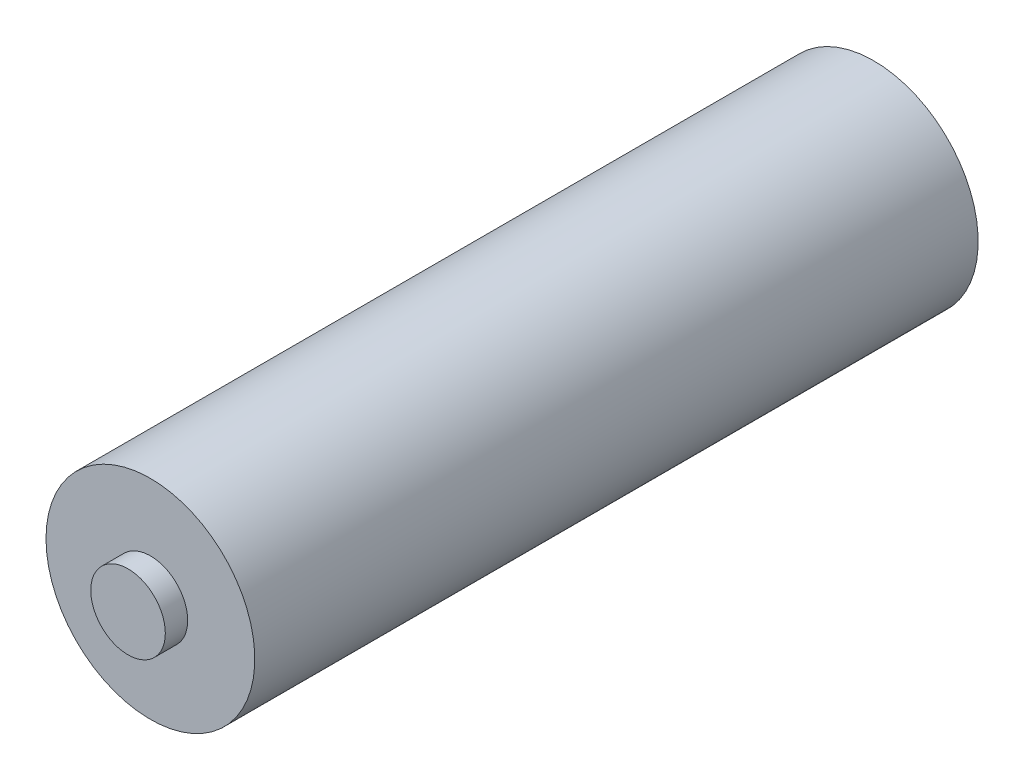
from build123d import *

# Parameters (mm, degrees)
CROQUIS1_R              = 7
SALIENTE_EXTRUIR1_DEPTH = 48.5
CROQUIS2_R              = 2.5
SALIENTE_EXTRUIR2_DEPTH = 1.5


with BuildPart() as part:
    # Croquis1 → Saliente-Extruir1 (new body)
    with BuildSketch(Plane.XY):
        with Locations(Location((0, 0, 0), (0, 0, 180))):
            Circle(CROQUIS1_R)
    extrude(amount=SALIENTE_EXTRUIR1_DEPTH)

    # Croquis2 → Saliente-Extruir2 (add)
    with BuildSketch(Plane.XY.offset(48.5)):
        Circle(CROQUIS2_R)
    extrude(amount=SALIENTE_EXTRUIR2_DEPTH)


solid = part.part
